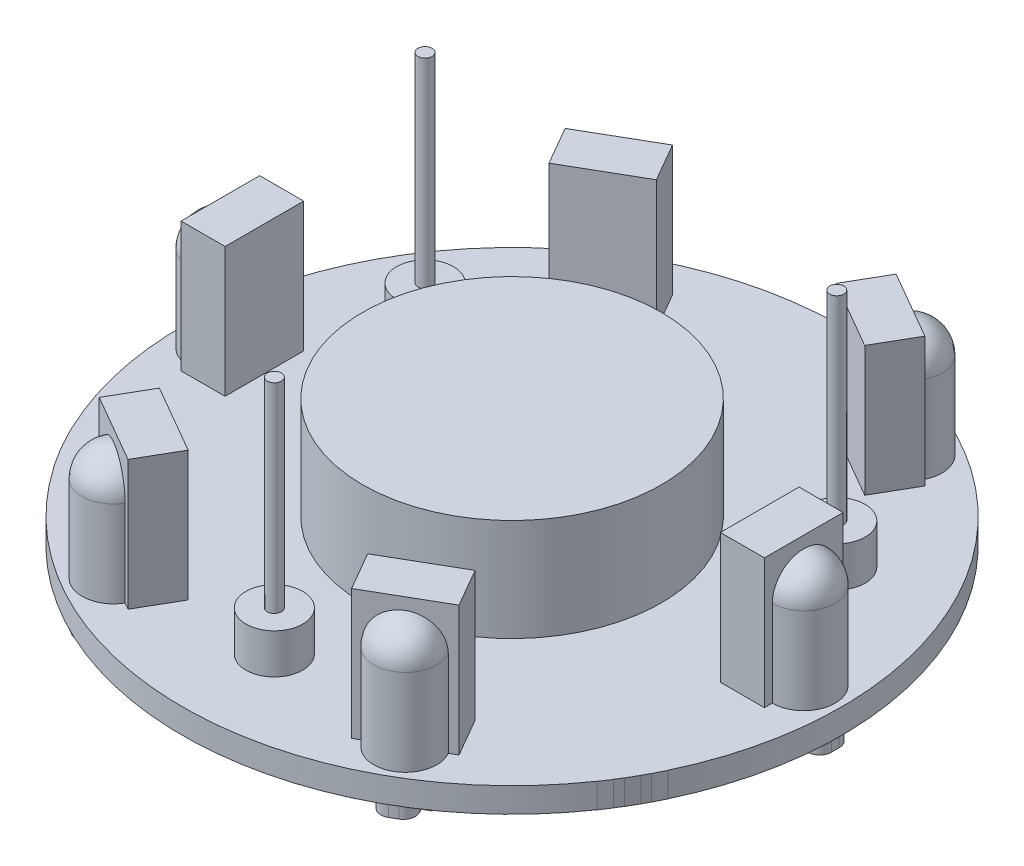
from build123d import *

# Parameters (mm, degrees)
BOSS_EXTRUDE1_DEPTH         = 0.7874
BOSS_EXTRUDE1_DEPTH_BACK    = 0.7874
SKETCH1_R                   = 20.955
SKETCH2_R                   = 1.8034
BOSS_EXTRUDE2_DEPTH         = 2.54
SKETCH3_R                   = 0.44958
BOSS_EXTRUDE3_DEPTH         = 12.7
CIRPATTERN1_COUNT           = 3
SKETCH4_R                   = 9.5
BOSS_EXTRUDE4_DEPTH         = 6.5
SKETCH5_W                   = 2.8
SKETCH5_H                   = 5
BOSS_EXTRUDE5_DEPTH         = 8.25
SKETCH6_R                   = 2
BOSS_EXTRUDE6_DEPTH         = 5.5
REVOLVE1_ANGLE              = 90
CIRPATTERN2_COUNT           = 6
SKETCH8_W                   = 1
SKETCH8_H                   = 3
BOSS_EXTRUDE7_DEPTH         = 1
SKETCH9_W                   = 2
SKETCH9_H                   = 2
BOSS_EXTRUDE8_DEPTH         = 1
FILLET1_R                   = 0.75
CIRPATTERN3_COUNT           = 6
FILLET1_OF_CIRPATTERN3_R    = 0.75
SKETCH11_W                  = 0.762
SKETCH11_H                  = 0.01
BOSS_EXTRUDE10_DEPTH        = 1.5748
CIRPATTERN4_COUNT           = 2
CIRPATTERN4_ANGLE           = 3.4725
CIRPATTERN5_COUNT           = 2
CIRPATTERN5_ANGLE           = 356.528
CIRPATTERN6_COUNT           = 3
CIRPATTERN6_COPY_1_SKETCH_W = 0.762
CIRPATTERN6_COPY_1_SKETCH_H = 0.01
CIRPATTERN6_COPY_1_DEPTH    = 1.5748
CIRPATTERN6_COPY_2_SKETCH_W = 0.762
CIRPATTERN6_COPY_2_SKETCH_H = 0.01
CIRPATTERN6_COPY_2_DEPTH    = 1.5748
CIRPATTERN6_COPY_3_SKETCH_W = 0.762
CIRPATTERN6_COPY_3_SKETCH_H = 0.01
CIRPATTERN6_COPY_3_DEPTH    = 1.5748
CIRPATTERN6_COPY_4_SKETCH_W = 0.762
CIRPATTERN6_COPY_4_SKETCH_H = 0.01
CIRPATTERN6_COPY_4_DEPTH    = 1.5748


with BuildPart() as part:
    # Sketch1 → Boss-Extrude1 (new, two sides: drawn at the far end of the back side and taken through both)
    with BuildSketch(Plane(origin=(0, 0, 0), x_dir=(1, 0, 0), z_dir=(0, 1, 0)).offset(-BOSS_EXTRUDE1_DEPTH_BACK)):
        with Locations(Location((20.955, 20.955, 0), (0, 0, 270))):
            Circle(SKETCH1_R)
    extrude(amount=BOSS_EXTRUDE1_DEPTH + BOSS_EXTRUDE1_DEPTH_BACK)

    # Sketch2 → Boss-Extrude2 (add)
    with BuildSketch(Plane(origin=(0, 0.7874, 0), x_dir=(1, 0, 0), z_dir=(0, 1, 0))):
        with Locations(Location((20.955, 5.842, 0), (0, 0, 270))):
            Circle(SKETCH2_R)
    boss_extrude2 = extrude(amount=BOSS_EXTRUDE2_DEPTH)

    # Sketch3 → Boss-Extrude3 (add)
    with BuildSketch(Plane(origin=(0, 3.3274, 0), x_dir=(1, 0, 0), z_dir=(0, 1, 0))):
        with Locations(Location((20.955, 5.842, 0), (0, 0, 270))):
            Circle(SKETCH3_R)
    boss_extrude3 = extrude(amount=BOSS_EXTRUDE3_DEPTH)

    # CirPattern1: Boss-Extrude2, Boss-Extrude3 ×3 about axis
    cirpattern1_axis = Axis((20.955, 0, -20.955), (0, 1, 0))
    add([boss_extrude2.rotate(cirpattern1_axis, i * 360 / CIRPATTERN1_COUNT) for i in range(1, CIRPATTERN1_COUNT)])
    add([boss_extrude3.rotate(cirpattern1_axis, i * 360 / CIRPATTERN1_COUNT) for i in range(1, CIRPATTERN1_COUNT)])

    # Sketch4 → Boss-Extrude4 (add)
    with BuildSketch(Plane(origin=(0, 0.7874, 0), x_dir=(1, 0, 0), z_dir=(0, 1, 0))):
        with Locations(Location((20.955, 20.955, 0), (0, 0, 90))):
            Circle(SKETCH4_R)
    extrude(amount=BOSS_EXTRUDE4_DEPTH)

    # Sketch5 → Boss-Extrude5 (add)
    with BuildSketch(Plane(origin=(0, 0.7874, 0), x_dir=(1, 0, 0), z_dir=(0, 1, 0))):
        with Locations((3.81, 20.955)):
            Rectangle(SKETCH5_W, SKETCH5_H)
    boss_extrude5 = extrude(amount=BOSS_EXTRUDE5_DEPTH)

    # Sketch6 → Boss-Extrude6 (add)
    with BuildSketch(Plane(origin=(0, 0.7874, 0), x_dir=(1, 0, 0), z_dir=(0, 1, 0))):
        with Locations((2.41, 20.955)):
            Circle(SKETCH6_R)
    boss_extrude6 = extrude(amount=BOSS_EXTRUDE6_DEPTH)

    # Sketch7 → Revolve1 (revolve)
    with BuildSketch(Plane(origin=(0, 6.2874, 0), x_dir=(1, 0, 0), z_dir=(0, 1, 0))):
        with BuildLine():
            Line((2.41, 22.955), (2.41, 18.955))
            ThreePointArc((2.41, 18.955), (0.41, 20.955), (2.41, 22.955))
        make_face()
    revolve1 = revolve(axis=Axis((2.41, 6.2874, -22.955), (0, 0, -1)), revolution_arc=REVOLVE1_ANGLE)

    # CirPattern2: Boss-Extrude5, Boss-Extrude6, Revolve1 ×6 about axis
    cirpattern2_axis = Axis((20.955, 0, -20.955), (0, 1, 0))
    add([boss_extrude5.rotate(cirpattern2_axis, i * 360 / CIRPATTERN2_COUNT) for i in range(1, CIRPATTERN2_COUNT)])
    add([boss_extrude6.rotate(cirpattern2_axis, i * 360 / CIRPATTERN2_COUNT) for i in range(1, CIRPATTERN2_COUNT)])
    add([revolve1.rotate(cirpattern2_axis, i * 360 / CIRPATTERN2_COUNT) for i in range(1, CIRPATTERN2_COUNT)])

    # Sketch8 → Boss-Extrude7 (add)
    with BuildSketch(Plane.XZ.offset(0.7874)):
        with Locations((1.905, -20.955)):
            Rectangle(SKETCH8_W, SKETCH8_H)
    boss_extrude7 = extrude(amount=BOSS_EXTRUDE7_DEPTH)

    # Sketch9 → Boss-Extrude8 (add)
    with BuildSketch(Plane.XZ.offset(0.7874)):
        with Locations((1.405, -20.955)):
            Rectangle(SKETCH9_W, SKETCH9_H)
    boss_extrude8 = extrude(amount=BOSS_EXTRUDE8_DEPTH)

    # Fillet1
    fillet1_edges = [part.edges().sort_by_distance(p)[0] for p in [
        (0.405, -1.2874, -21.955),
        (0.405, -1.2874, -19.955),
    ]]
    fillet(fillet1_edges, radius=FILLET1_R)

    # CirPattern3: Boss-Extrude7, Boss-Extrude8 ×6 about axis
    cirpattern3_axis = Axis((20.955, 0, -20.955), (0, 1, 0))
    add([boss_extrude7.rotate(cirpattern3_axis, i * 360 / CIRPATTERN3_COUNT) for i in range(1, CIRPATTERN3_COUNT)])
    add([boss_extrude8.rotate(cirpattern3_axis, i * 360 / CIRPATTERN3_COUNT) for i in range(1, CIRPATTERN3_COUNT)])

    # Fillet1 of CirPattern3
    fillet1_of_cirpattern3_edges = [part.edges().sort_by_distance(p)[0] for p in [
        (9.813974596, -1.2874, -3.658177952),
        (11.546025404, -1.2874, -2.658177952),
        (30.363974596, -1.2874, -2.658177952),
        (32.096025404, -1.2874, -3.658177952),
        (41.505, -1.2874, -19.955),
        (41.505, -1.2874, -21.955),
        (32.096025404, -1.2874, -38.251822048),
        (30.363974596, -1.2874, -39.251822048),
        (11.546025404, -1.2874, -39.251822048),
        (9.813974596, -1.2874, -38.251822048),
    ]]
    fillet(fillet1_of_cirpattern3_edges, radius=FILLET1_OF_CIRPATTERN3_R)

    # Sketch11 → Boss-Extrude10 (add)
    with BuildSketch(Plane(origin=(0, 0.7874, 0), x_dir=(-1, 0, 0), z_dir=(0, 1, 0))):
        with Locations((-20.955, -41.91)):
            Rectangle(SKETCH11_W, SKETCH11_H)
    boss_extrude10 = extrude(amount=-BOSS_EXTRUDE10_DEPTH)

    # CirPattern4: Boss-Extrude10 ×2 about axis
    cirpattern4_axis = Axis((20.955, 0, -20.955), (0, 1, 0))
    for i in range(1, CIRPATTERN4_COUNT):
        add(boss_extrude10.rotate(cirpattern4_axis, i * CIRPATTERN4_ANGLE / (CIRPATTERN4_COUNT - 1)))

    # CirPattern5: Boss-Extrude10 ×2 about axis
    cirpattern5_axis = Axis((20.955, 0.7874, -20.955), (0, 1, 0))
    for i in range(1, CIRPATTERN5_COUNT):
        add(boss_extrude10.rotate(cirpattern5_axis, i * CIRPATTERN5_ANGLE / (CIRPATTERN5_COUNT - 1)))

    # CirPattern6: Boss-Extrude10 ×3 about axis
    cirpattern6_axis = Axis((20.955, 0, -20.955), (0, 1, 0))
    for i in range(1, CIRPATTERN6_COUNT):
        add(boss_extrude10.rotate(cirpattern6_axis, i * 360 / CIRPATTERN6_COUNT))

    # CirPattern6 copy 1 sketch → CirPattern6 copy 1 (add)
    with BuildSketch(Plane(origin=(49.992077833, 0.7874, -15.032824647), x_dir=(0.5515366852909422, 0, 0.8341506367427168), z_dir=(0, 1, 0))):
        with Locations((-20.955, -41.91)):
            Rectangle(CIRPATTERN6_COPY_1_SKETCH_W, CIRPATTERN6_COPY_1_SKETCH_H)
    extrude(amount=-CIRPATTERN6_COPY_1_DEPTH)

    # CirPattern6 copy 2 sketch → CirPattern6 copy 2 (add)
    with BuildSketch(Plane(origin=(11.565215384, 0.7874, -49.062934732), x_dir=(0.4466272993566871, 0, -0.8947200989523774), z_dir=(0, 1, 0))):
        with Locations((-20.955, -41.91)):
            Rectangle(CIRPATTERN6_COPY_2_SKETCH_W, CIRPATTERN6_COPY_2_SKETCH_H)
    extrude(amount=-CIRPATTERN6_COPY_2_DEPTH)

    # CirPattern6 copy 3 sketch → CirPattern6 copy 3 (add)
    with BuildSketch(Plane(origin=(49.063016672, 0.7874, -11.565460673), x_dir=(0.44663510724549776, 0, 0.8947162013598516), z_dir=(0, 1, 0))):
        with Locations((-20.955, -41.91)):
            Rectangle(CIRPATTERN6_COPY_3_SKETCH_W, CIRPATTERN6_COPY_3_SKETCH_H)
    extrude(amount=-CIRPATTERN6_COPY_3_DEPTH)

    # CirPattern6 copy 4 sketch → CirPattern6 copy 4 (add)
    with BuildSketch(Plane(origin=(15.032571251, 0.7874, -49.992026151), x_dir=(0.551529405932396, 0, -0.834155449776514), z_dir=(0, 1, 0))):
        with Locations((-20.955, -41.91)):
            Rectangle(CIRPATTERN6_COPY_4_SKETCH_W, CIRPATTERN6_COPY_4_SKETCH_H)
    extrude(amount=-CIRPATTERN6_COPY_4_DEPTH)


solid = part.part
